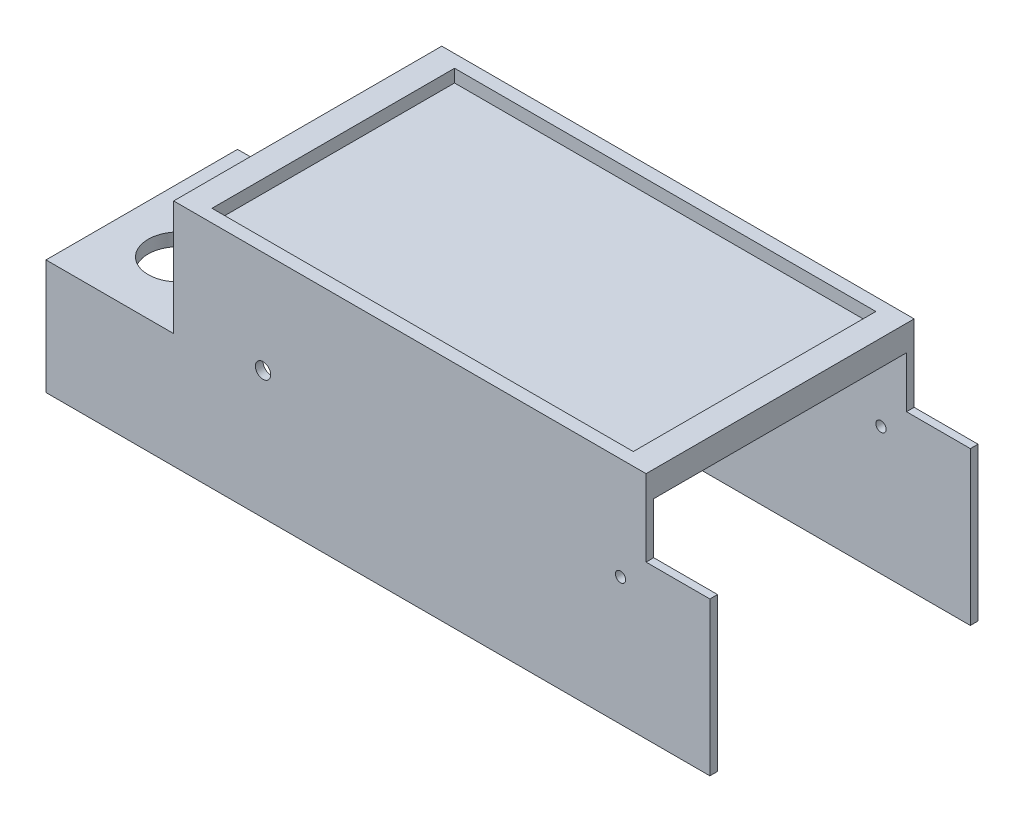
from build123d import *

# Parameters (mm, degrees)
SKETCH_2_W          = 210
SKETCH_2_H          = 105
EXTRUDE_1_DEPTH     = 90
SKETCH_4_W          = 165
SKETCH_4_H          = 95
CUT_EXTRUDE_1_DEPTH = 5
SKETCH_5_W          = 99
SKETCH_5_H          = 80
CUT_EXTRUDE_2_DEPTH = 200
SKETCH_6_W          = 75
SKETCH_6_H          = 45
EXTRUDE_2_DEPTH     = 50
SKETCH_7_W          = 69
SKETCH_7_H          = 40
CUT_EXTRUDE_3_DEPTH = 281.100428418
SKETCH_8_R          = 12
CUT_EXTRUDE_4_DEPTH = 170.724040725
SKETCH_9_R          = 3
SKETCH_9_R_2        = 2
CUT_EXTRUDE_5_DEPTH = 208.725780778
SKETCH_11_W         = 25
SKETCH_11_H         = 105
CUT_EXTRUDE_6_DEPTH = 30


with BuildPart() as part:
    # 草图2 → 凸台-拉伸1 (new body)
    with BuildSketch(Plane(origin=(0, 0, 0), x_dir=(1, 0, 0), z_dir=(0, 1, 0))):
        Rectangle(SKETCH_2_W, SKETCH_2_H)
    extrude(amount=EXTRUDE_1_DEPTH)

    # 草图4 → 切除-拉伸1 (cut)
    with BuildSketch(Plane(origin=(0, 90, 0), x_dir=(1, 0, 0), z_dir=(0, 1, 0))):
        with Locations((-12.5, 0)):
            Rectangle(SKETCH_4_W, SKETCH_4_H)
    extrude(amount=-CUT_EXTRUDE_1_DEPTH, mode=Mode.SUBTRACT)

    # 草图5 → 切除-拉伸2 (cut)
    with BuildSketch(Plane(origin=(105, 0, 0), x_dir=(0, 0, -1), z_dir=(1, 0, 0))):
        with Locations((0, 40)):
            Rectangle(SKETCH_5_W, SKETCH_5_H)
    extrude(amount=-CUT_EXTRUDE_2_DEPTH, mode=Mode.SUBTRACT)

    # 草图6 → 凸台-拉伸2 (add)
    with BuildSketch(Plane.ZY.offset(105)):
        with Locations((15, 22.5)):
            Rectangle(SKETCH_6_W, SKETCH_6_H)
    extrude(amount=EXTRUDE_2_DEPTH)

    # 草图7 → 切除-拉伸3 (cut, through all)
    with BuildSketch(Plane.ZY.offset(155)):
        with Locations((15, 20)):
            Rectangle(SKETCH_7_W, SKETCH_7_H)
    extrude(amount=-CUT_EXTRUDE_3_DEPTH, mode=Mode.SUBTRACT)

    # 草图8 → 切除-拉伸4 (cut, through all)
    with BuildSketch(Plane(origin=(0, 45, 0), x_dir=(1, 0, 0), z_dir=(0, 1, 0))):
        with Locations(Location((-130, -25.5, 0), (0, 0, 270))):
            Circle(SKETCH_8_R)
    extrude(amount=-CUT_EXTRUDE_4_DEPTH, mode=Mode.SUBTRACT)

    # 草图9 → 切除-拉伸5 (cut, through all)
    with BuildSketch(Plane.XY.offset(52.5)):
        with Locations((-70, 50)):
            Circle(SKETCH_9_R)
        with Locations((70, 50)):
            Circle(SKETCH_9_R_2)
    extrude(amount=-CUT_EXTRUDE_5_DEPTH, mode=Mode.SUBTRACT)

    # 草图11 → 切除-拉伸6 (cut)
    with BuildSketch(Plane(origin=(0, 90, 0), x_dir=(1, 0, 0), z_dir=(0, 1, 0))):
        with Locations((92.5, 0)):
            Rectangle(SKETCH_11_W, SKETCH_11_H)
    extrude(amount=-CUT_EXTRUDE_6_DEPTH, mode=Mode.SUBTRACT)


solid = part.part
